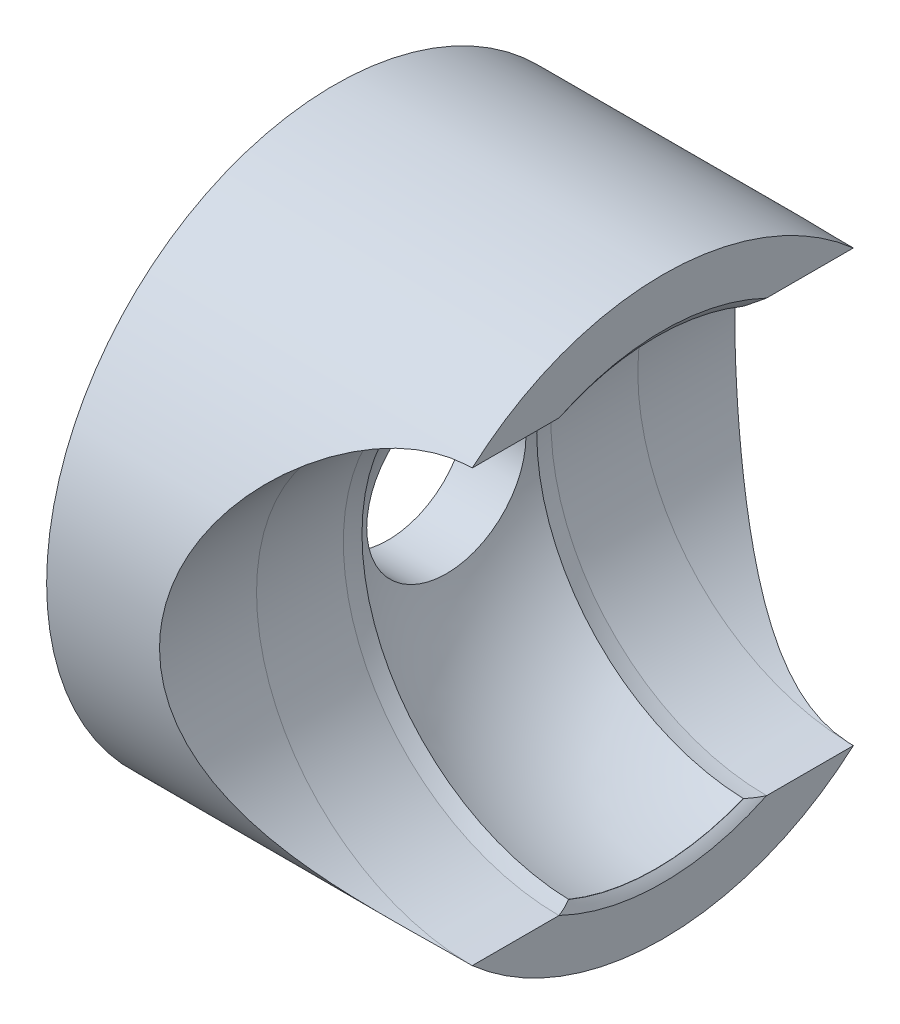
from build123d import *


with BuildPart() as part:
    # Çizim1 → Döndür1 (revolve)
    with BuildSketch(Plane(origin=(0, 0, 0), x_dir=(1, 0, 0), z_dir=(0, 1, 0)), mode=Mode.PRIVATE) as d_nd_r1_sk:
        with BuildLine():
            Line((12.781543507, 13.383116119), (-2.50303312, 13.383116119))
            ThreePointArc((-2.50303312, 13.383116119), (-2.501361875, 13.293526957), (-2.506133274, 13.204049335))
            Line((-2.506133274, 13.204049335), (-2.506133274, 9.63773694))
            Line((-2.506133274, 9.63773694), (0, 9.63773694))
            Line((0, 9.63773694), (0, 3.705))
            Line((0, 3.705), (4.808638309, 3.705))
            ThreePointArc((4.808638309, 3.705), (5.009621244, 3.664180843), (5.185678757, 3.558994837))
            ThreePointArc((5.185678757, 3.558994837), (7.965698705, 8.014106646), (12.465543511, 10.721121396))
            ThreePointArc((12.465543511, 10.721121396), (12.633558311, 10.915283437), (12.780786925, 11.125644095))
            Line((12.780786925, 11.125644095), (12.781543507, 13.383116119))
        make_face()
    revolve(d_nd_r1_sk.sketch.rotate(Axis((0, 0, 0), (1, 0, 0)), 180), axis=Axis((0, 0, 0), (1, 0, 0)))

    # Çizim2 → Kes-Döndür3 (revolve, cut)
    with BuildSketch(Plane.ZY.offset(-12.773866726)):
        with BuildLine():
            Line((13.385193973, 0), (-13.385193973, 0))
            Line((-13.385193973, 0), (-16.077753665, 0))
            Line((-16.077753665, 0), (-16.077753665, 10.025014185))
            Line((-16.077753665, 10.025014185), (-8.869188704, 10.025014185))
            add(Edge.make_bspline(
                [(-4.830106972, 10.024782411), (-6.17646756, 10.024842425), (-7.522828137, 10.024922597), (-8.869188704, 10.025014185)],
                knots=[0.002442016, 0.002442016, 0.002442016, 0.002442016, 0.006481098, 0.006481098, 0.006481098, 0.006481098], degree=3))
            add(Edge.make_bspline(
                [(-4.065295391, 9.922720168), (-4.309706946, 9.966250241), (-4.566541382, 9.998257381), (-4.830106972, 10.024782411)],
                knots=[0, 0, 0, 0, 1, 1, 1, 1], degree=3))
            ThreePointArc((-4.065295391, 9.922720168), (0, 10.723199249), (4.065295391, 9.922720168))
            add(Edge.make_bspline(
                [(4.830106972, 10.024782411), (4.567249442, 9.99832864), (4.310513413, 9.966393874), (4.065295391, 9.922720168)],
                knots=[0, 0, 0, 0, 1, 1, 1, 1], degree=3))
            add(Edge.make_bspline(
                [(8.869188704, 10.025014185), (7.522828137, 10.024922597), (6.17646756, 10.024842425), (4.830106972, 10.024782411)],
                knots=[-0.01125728, -0.01125728, -0.01125728, -0.01125728, -0.007218198, -0.007218198, -0.007218198, -0.007218198], degree=3))
            Line((8.869188704, 10.025014185), (15.518432284, 10.025014185))
            Line((15.518432284, 10.025014185), (15.518432284, 0))
            Line((15.518432284, 0), (13.385193973, 0))
        make_face()
    revolve(axis=Axis((12.773866726, 0, -16.077753665), (0, 0, 1)), mode=Mode.SUBTRACT)


solid = part.part
